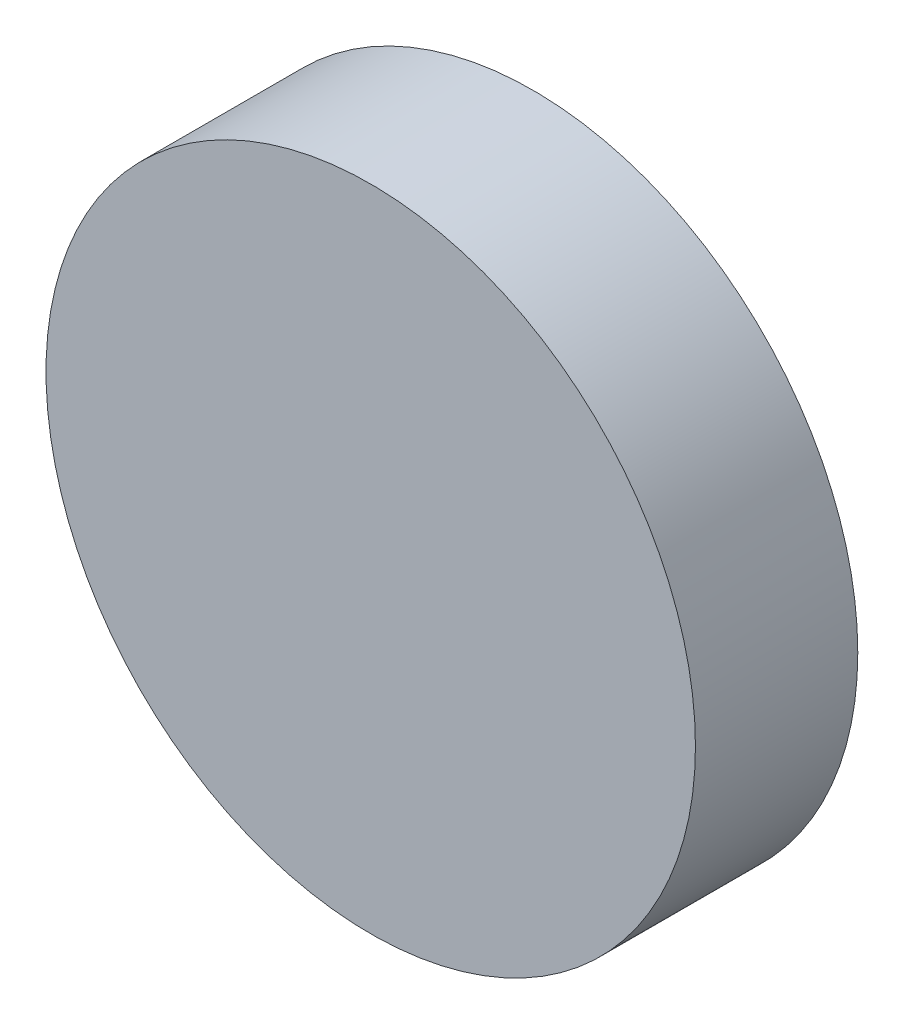
from build123d import *

# Parameters (mm, degrees)
SKETCH1_R           = 25.4
SKETCH1_R_2         = 23.876
BOSS_EXTRUDE1_DEPTH = 12.7
BOSS_EXTRUDE2_START = -2.54
SKETCH2_R           = 23.876
BOSS_EXTRUDE2_DEPTH = 2.54


with BuildPart() as part:
    # Sketch1 → Boss-Extrude1 (new body)
    with BuildSketch(Plane.XY):
        Circle(SKETCH1_R)
        Circle(SKETCH1_R_2, mode=Mode.SUBTRACT)
    extrude(amount=BOSS_EXTRUDE1_DEPTH)

    # Sketch2 → Boss-Extrude2 (add)
    with BuildSketch(Plane.XY.offset(12.7).offset(BOSS_EXTRUDE2_START)):
        Circle(SKETCH2_R)
    extrude(amount=BOSS_EXTRUDE2_DEPTH)


solid = part.part
